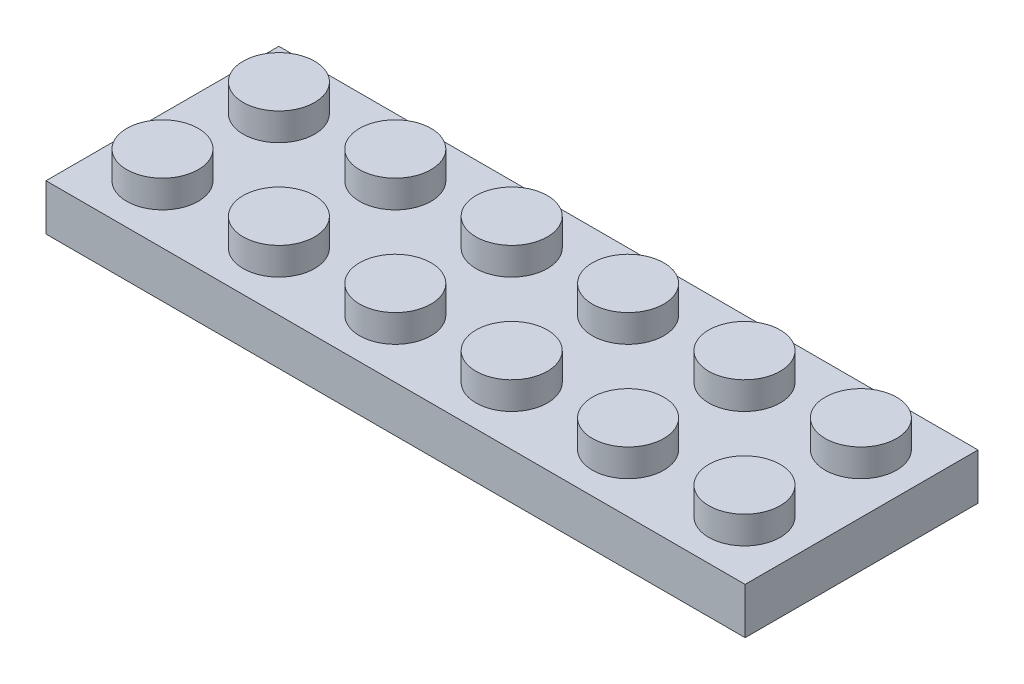
from build123d import *

# Parameters (mm, degrees)
SKETCH2_W           = 47.81
SKETCH2_H           = 15.925
BOSS_EXTRUDE1_DEPTH = 3.16
SKETCH3_R           = 2.445
BOSS_EXTRUDE2_DEPTH = 1.88
SHELL1_T            = -1.45
SKETCH4_R           = 3.15
SKETCH4_R_2         = 2.34
BOSS_EXTRUDE3_DEPTH = 1.51


with BuildPart() as part:
    # Sketch2 → Boss-Extrude1 (new body)
    with BuildSketch(Plane(origin=(0, 0, 0), x_dir=(1, 0, 0), z_dir=(0, 1, 0))):
        Rectangle(SKETCH2_W, SKETCH2_H)
    extrude(amount=-BOSS_EXTRUDE1_DEPTH)

    # Sketch3 → Boss-Extrude2 (add)
    with BuildSketch(Plane(origin=(0, 0, 0), x_dir=(1, 0, 0), z_dir=(0, 1, 0))):
        with Locations(Location((-19.920833333, 3.98, 0), (0, 0, 270))):
            Circle(SKETCH3_R)
        with Locations(Location((-11.960833333, 3.98, 0), (0, 0, 270))):
            Circle(SKETCH3_R)
        with Locations(Location((-4.000833333, 3.98, 0), (0, 0, 270))):
            Circle(SKETCH3_R)
        with Locations(Location((3.959166667, 3.98, 0), (0, 0, 270))):
            Circle(SKETCH3_R)
        with Locations(Location((11.919166667, 3.98, 0), (0, 0, 270))):
            Circle(SKETCH3_R)
        with Locations(Location((19.879166667, 3.98, 0), (0, 0, 270))):
            Circle(SKETCH3_R)
        with Locations(Location((-11.960833333, -3.98, 0), (0, 0, 270))):
            Circle(SKETCH3_R)
        with Locations(Location((-4.000833333, -3.98, 0), (0, 0, 270))):
            Circle(SKETCH3_R)
        with Locations(Location((3.959166667, -3.98, 0), (0, 0, 270))):
            Circle(SKETCH3_R)
        with Locations(Location((11.919166667, -3.98, 0), (0, 0, 270))):
            Circle(SKETCH3_R)
        with Locations(Location((19.879166667, -3.98, 0), (0, 0, 270))):
            Circle(SKETCH3_R)
        with Locations(Location((-19.920833333, -3.98, 0), (0, 0, 270))):
            Circle(SKETCH3_R)
    extrude(amount=BOSS_EXTRUDE2_DEPTH)

    # Shell1
    shell1_openings = [part.faces().sort_by_distance(p)[0] for p in [
        (0, -3.16, 0),
    ]]
    offset(amount=SHELL1_T, openings=shell1_openings, kind=Kind.INTERSECTION)

    # Sketch4 → Boss-Extrude3 (add)
    # profile 1 of 5: a face of its own
    with BuildSketch(Plane.XZ.offset(1.45)):
        with Locations(Location((-15.936666667, 0.0025, 0), (0, 0, 90))):
            Circle(SKETCH4_R)
        with Locations(Location((-15.936666667, 0.0025, 0), (0, 0, 90))):
            Circle(SKETCH4_R_2, mode=Mode.SUBTRACT)
    # profile 2 of 5: a face of its own
    with BuildSketch(Plane.XZ.offset(1.45)):
        with Locations(Location((-7.966666667, 0.0025, 0), (0, 0, 90))):
            Circle(SKETCH4_R)
        with Locations(Location((-7.966666667, 0.0025, 0), (0, 0, 90))):
            Circle(SKETCH4_R_2, mode=Mode.SUBTRACT)
    # profile 3 of 5: a face of its own
    with BuildSketch(Plane.XZ.offset(1.45)):
        with Locations(Location((0.003333333, 0.0025, 0), (0, 0, 90))):
            Circle(SKETCH4_R)
        with Locations(Location((0.003333333, 0.0025, 0), (0, 0, 90))):
            Circle(SKETCH4_R_2, mode=Mode.SUBTRACT)
    # profile 4 of 5: a face of its own
    with BuildSketch(Plane.XZ.offset(1.45)):
        with Locations(Location((7.973333333, 0.0025, 0), (0, 0, 90))):
            Circle(SKETCH4_R)
        with Locations(Location((7.973333333, 0.0025, 0), (0, 0, 90))):
            Circle(SKETCH4_R_2, mode=Mode.SUBTRACT)
    # profile 5 of 5: a face of its own
    with BuildSketch(Plane.XZ.offset(1.45)):
        with Locations(Location((15.943333333, 0.0025, 0), (0, 0, 90))):
            Circle(SKETCH4_R)
        with Locations(Location((15.943333333, 0.0025, 0), (0, 0, 90))):
            Circle(SKETCH4_R_2, mode=Mode.SUBTRACT)
    extrude(amount=BOSS_EXTRUDE3_DEPTH)


solid = part.part
